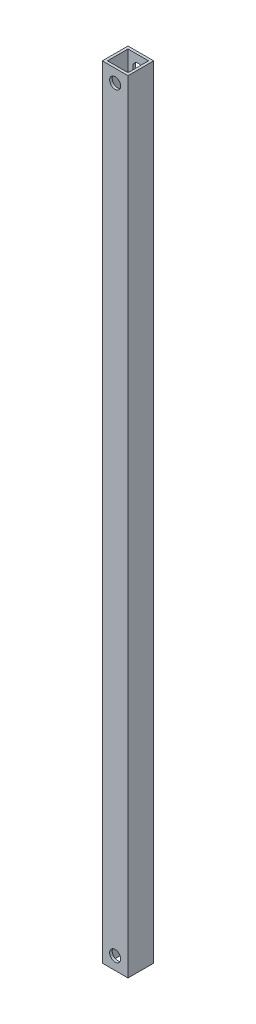
from build123d import *

# Parameters (mm, degrees)
SKETCH_1_W          = 10
SKETCH_1_H          = 10
SKETCH_1_W_2        = 8
SKETCH_1_H_2        = 8
EXTRUDE_1_DEPTH     = 304.359049462
SKETCH_2_R          = 2.15
CUT_EXTRUDE_1_DEPTH = 305.564329804


with BuildPart() as part:
    # ｽｹｯﾁ1 → 押し出し-薄板1 (new body)
    with BuildSketch(Plane(origin=(0, 0, 0), x_dir=(1, 0, 0), z_dir=(0, 1, 0))):
        Rectangle(SKETCH_1_W, SKETCH_1_H)
        Rectangle(SKETCH_1_W_2, SKETCH_1_H_2, mode=Mode.SUBTRACT)
    extrude(amount=EXTRUDE_1_DEPTH)

    # ｽｹｯﾁ2 → ｶｯﾄ - 押し出し1 (cut, through all)
    with BuildSketch(Plane.XY.offset(5)):
        with Locations((0, 299.359049462)):
            Circle(SKETCH_2_R)
        with Locations(Location((0, 5, 0), (0, 0, 180))):
            Circle(SKETCH_2_R)
    extrude(amount=-CUT_EXTRUDE_1_DEPTH, mode=Mode.SUBTRACT)


solid = part.part
